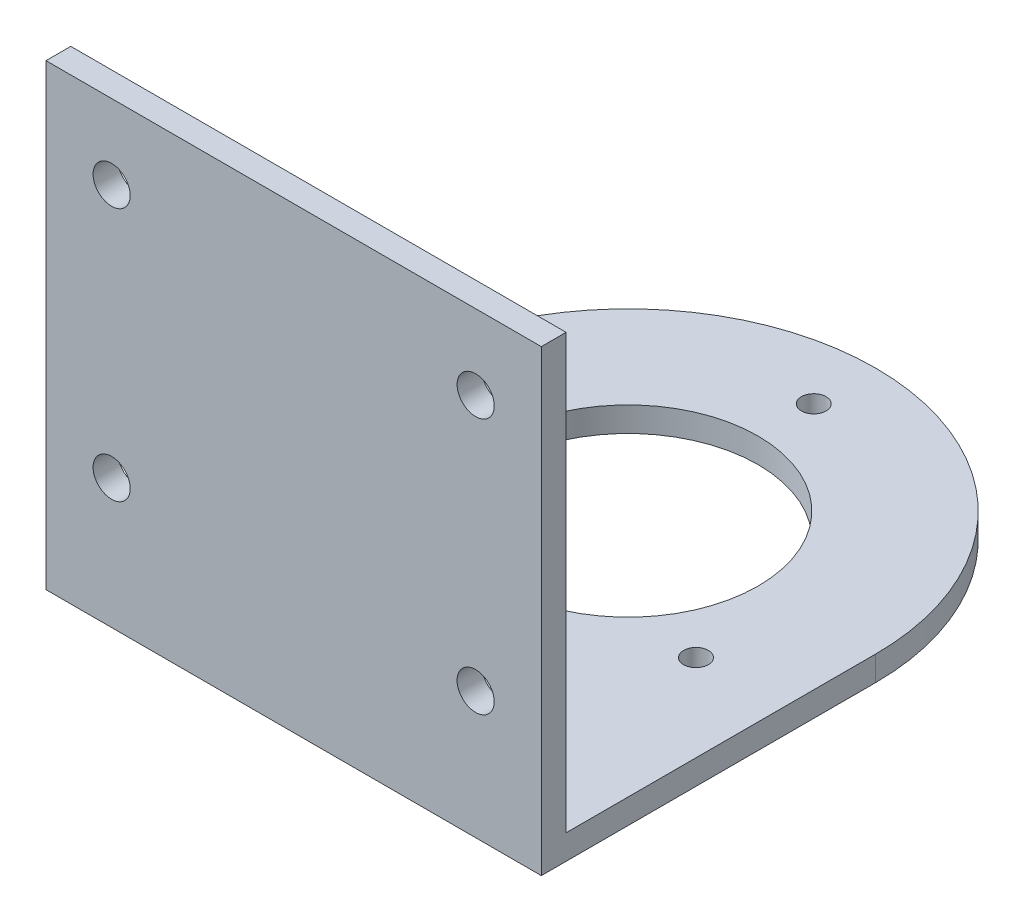
from build123d import *

# Parameters (mm, degrees)
SKETCH1_R           = 10.5
BOSS_EXTRUDE2_DEPTH = 2
SKETCH2_W           = 40
SKETCH2_H           = 2
BOSS_EXTRUDE3_DEPTH = 35
CUT_EXTRUDE1_DEPTH  = 35
CIRPATTERN1_COUNT   = 3
SKETCH5_R           = 1.5
CUT_EXTRUDE2_DEPTH  = 35
SKETCH6_R           = 1.5
CUT_EXTRUDE3_DEPTH  = 35


with BuildPart() as part:
    # Sketch1 → Boss-Extrude2 (new body)
    with BuildSketch(Plane(origin=(0, 0, 0), x_dir=(1, 0, 0), z_dir=(0, 1, 0))):
        with BuildLine():
            Line((-18.229166667, 5.4375), (-18.229166667, -21.5625))
            Line((-18.229166667, -21.5625), (21.770833333, -21.5625))
            Line((21.770833333, -21.5625), (21.770833333, 5.4375))
            ThreePointArc((21.770833333, 5.4375), (1.770833333, 25.4375), (-18.229166667, 5.4375))
        make_face()
        with Locations(Location((1.770833333, 5.4375, 0), (0, 0, 270))):
            Circle(SKETCH1_R, mode=Mode.SUBTRACT)
    extrude(amount=BOSS_EXTRUDE2_DEPTH)

    # Sketch2 → Boss-Extrude3 (add)
    with BuildSketch(Plane(origin=(0, 2, 0), x_dir=(1, 0, 0), z_dir=(0, 1, 0))):
        with Locations((1.770833333, -20.5625)):
            Rectangle(SKETCH2_W, SKETCH2_H)
    extrude(amount=BOSS_EXTRUDE3_DEPTH)

    # Sketch4 → Cut-Extrude1 (cut)
    with BuildSketch(Plane(origin=(0, 2, 0), x_dir=(1, 0, 0), z_dir=(0, 1, 0))):
        with BuildLine():
            ThreePointArc((1.770833333, 21.4375), (0.770833333, 20.4375), (1.770833333, 19.4375))
            Line((1.770833333, 19.4375), (1.770833333, 21.4375))
        make_face()
        with BuildLine():
            Line((1.770833333, 21.4375), (1.770833333, 19.4375))
            ThreePointArc((1.770833333, 19.4375), (2.477940115, 19.730393219), (2.770833333, 20.4375))
            ThreePointArc((2.770833333, 20.4375), (2.477940115, 21.144606781), (1.770833333, 21.4375))
        make_face()
    cut_extrude1 = extrude(amount=-CUT_EXTRUDE1_DEPTH, mode=Mode.SUBTRACT)

    # CirPattern1: Cut-Extrude1 ×3 about axis
    cirpattern1_axis = Axis((1.770833333, 0, -5.4375), (0, 1, 0))
    for i in range(1, CIRPATTERN1_COUNT):
        add(cut_extrude1.rotate(cirpattern1_axis, i * 360 / CIRPATTERN1_COUNT), mode=Mode.SUBTRACT)

    # Sketch5 → Cut-Extrude2 (cut)
    with BuildSketch(Plane(origin=(0, 0, 19.5625), x_dir=(-1, 0, 0), z_dir=(0, 0, -1))):
        with Locations((-16.466888349, 10.262371912)):
            Circle(SKETCH5_R)
        with Locations((-16.470833333, 30.952470071)):
            Circle(SKETCH5_R)
    extrude(amount=-CUT_EXTRUDE2_DEPTH, mode=Mode.SUBTRACT)

    # Sketch6 → Cut-Extrude3 (cut)
    with BuildSketch(Plane(origin=(0, 0, 19.5625), x_dir=(-1, 0, 0), z_dir=(0, 0, -1))):
        with Locations((12.929166667, 30.96416702)):
            Circle(SKETCH6_R)
        with Locations((12.929166667, 10.470851603)):
            Circle(SKETCH6_R)
    extrude(amount=-CUT_EXTRUDE3_DEPTH, mode=Mode.SUBTRACT)


solid = part.part
